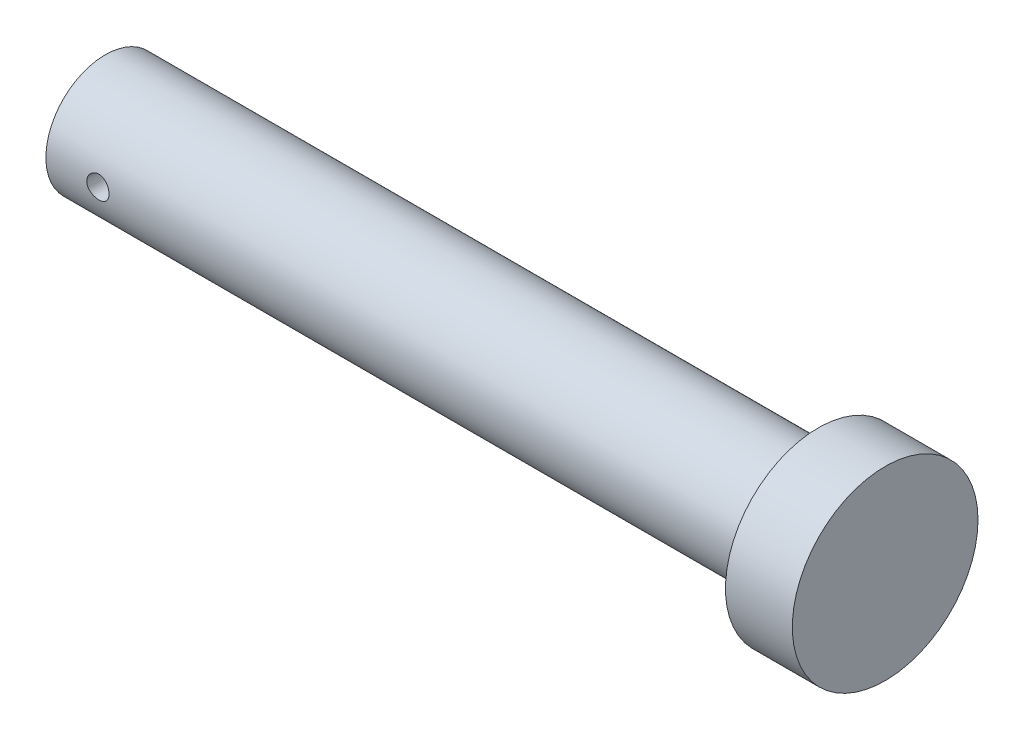
from build123d import *

# Parameters (mm, degrees)
SKETCH1_R               = 8
BOSS_EXTRUDE1_DEPTH     = 96
SKETCH4_R               = 12.5
BOSS_EXTRUDE2_DEPTH     = 9
CUT_EXTRUDE1_DEPTH      = 107.477697195
CUT_EXTRUDE1_DEPTH_BACK = 107.477697195
SKETCH5_R               = 1.5


with BuildPart() as part:
    # Sketch1 → Boss-Extrude1 (new body)
    with BuildSketch(Plane(origin=(0, 0, 0), x_dir=(0, 0, -1), z_dir=(1, 0, 0))):
        Circle(SKETCH1_R)
    extrude(amount=BOSS_EXTRUDE1_DEPTH)

    # Sketch4 → Boss-Extrude2 (add)
    with BuildSketch(Plane(origin=(96, 0, 0), x_dir=(0, 0, -1), z_dir=(1, 0, 0))):
        Circle(SKETCH4_R)
    extrude(amount=BOSS_EXTRUDE2_DEPTH)

    # Sketch5 → Cut-Extrude1 (cut, two sides: drawn at the far end of the back side and taken through both)
    with BuildSketch(Plane.XY.offset(-CUT_EXTRUDE1_DEPTH_BACK)):
        with Locations((7, 0)):
            Circle(SKETCH5_R)
    extrude(amount=CUT_EXTRUDE1_DEPTH + CUT_EXTRUDE1_DEPTH_BACK, mode=Mode.SUBTRACT)


solid = part.part
